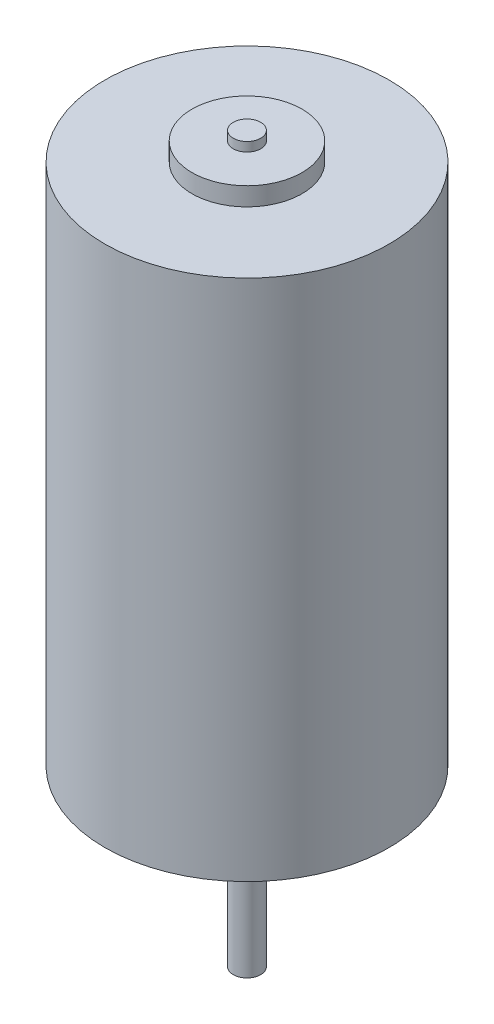
from build123d import *

# Parameters (mm, degrees)
TROU_TARAUD_M3X0_51_D     = 2.5
TROU_TARAUD_M3X0_51_DEPTH = 8.5
TROU_TARAUD_M3X0_51_TIP   = 0.751075774


with BuildPart() as part:
    # Esquisse1 → Révolution1 (revolve)
    with BuildSketch(Plane.XY, mode=Mode.PRIVATE) as r_volution1_sk:
        Polygon((0, -19), (0, 60), (1.5, 60), (1.5, 59), (6, 59), (6, 57), (15.5, 57), (15.5, 0), (6, 0), (6, -3.5), (1.5, -3.5), (1.5, -19), align=None)
    revolve(r_volution1_sk.sketch.rotate(Axis((0, 0, 0), (0, 1, 0)), 90), axis=Axis((0, 0, 0), (0, 1, 0)))

    # Trou taraudé M3x0.51
    with Locations(Plane(origin=(0, 0, 0), x_dir=(-1, 0, 0), z_dir=(0, -1, 0))):
        with Locations((0, -11), (-11, 0), (0, 11), (11, 0)):
            Hole(TROU_TARAUD_M3X0_51_D / 2, depth=TROU_TARAUD_M3X0_51_DEPTH)
            with Locations((0, 0, -(TROU_TARAUD_M3X0_51_DEPTH + TROU_TARAUD_M3X0_51_TIP / 2))):  # 118° drill point
                Cone(0, TROU_TARAUD_M3X0_51_D / 2, TROU_TARAUD_M3X0_51_TIP, mode=Mode.SUBTRACT)


solid = part.part
